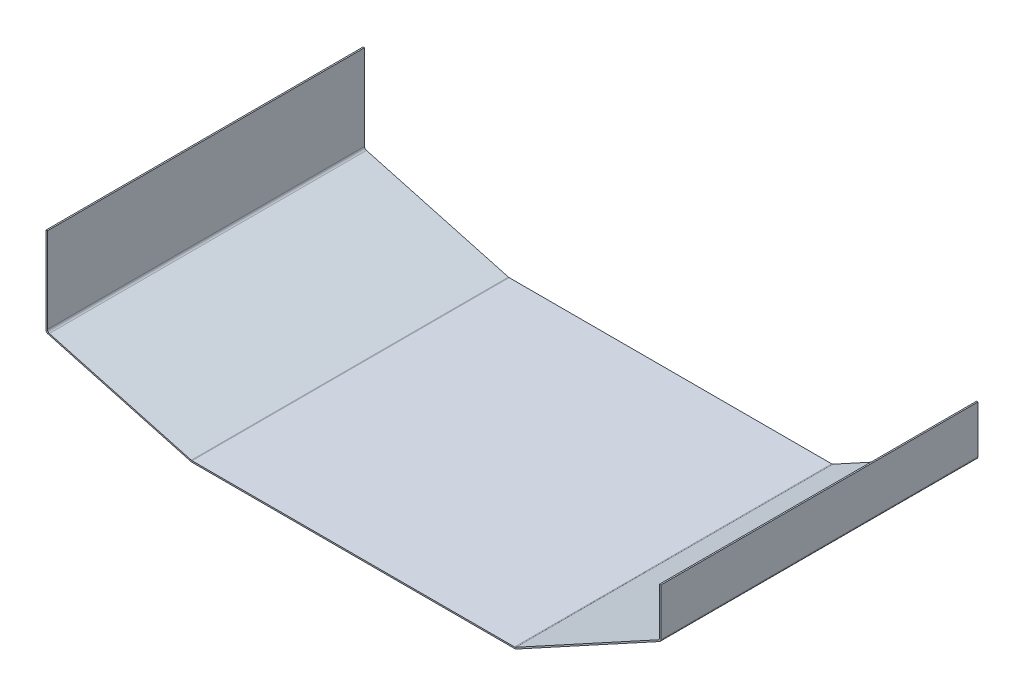
from build123d import *

# Parameters (mm, degrees)
EXTRUDE_THIN1_DEPTH = 362.7
FILLET1_R           = 3


with BuildPart() as part:
    # Sketch1 → Extrude-Thin1 (new body)
    with BuildSketch(Plane.XY):
        Polygon((0, 0), (0, -100), (165, -145), (535, -145), (700, -55), (700, 0), (701.5875, 0), (701.5875, -55.942392544), (535.404802998, -146.5875), (164.787405042, -146.5875), (-1.5875, -101.212525898), (-1.5875, 0), align=None)
    extrude(amount=EXTRUDE_THIN1_DEPTH)

    # Fillet1
    fillet1_edges = [part.edges().sort_by_distance(p)[0] for p in [
        (700, -55, 181.35),
        (535, -145, 181.35),
        (165, -145, 181.35),
        (0, -100, 181.35),
        (-1.5875, -101.212525898, 181.35),
        (164.787405042, -146.5875, 181.35),
        (535.404802998, -146.5875, 181.35),
        (701.5875, -55.942392544, 181.35),
    ]]
    fillet(fillet1_edges, radius=FILLET1_R)


solid = part.part
